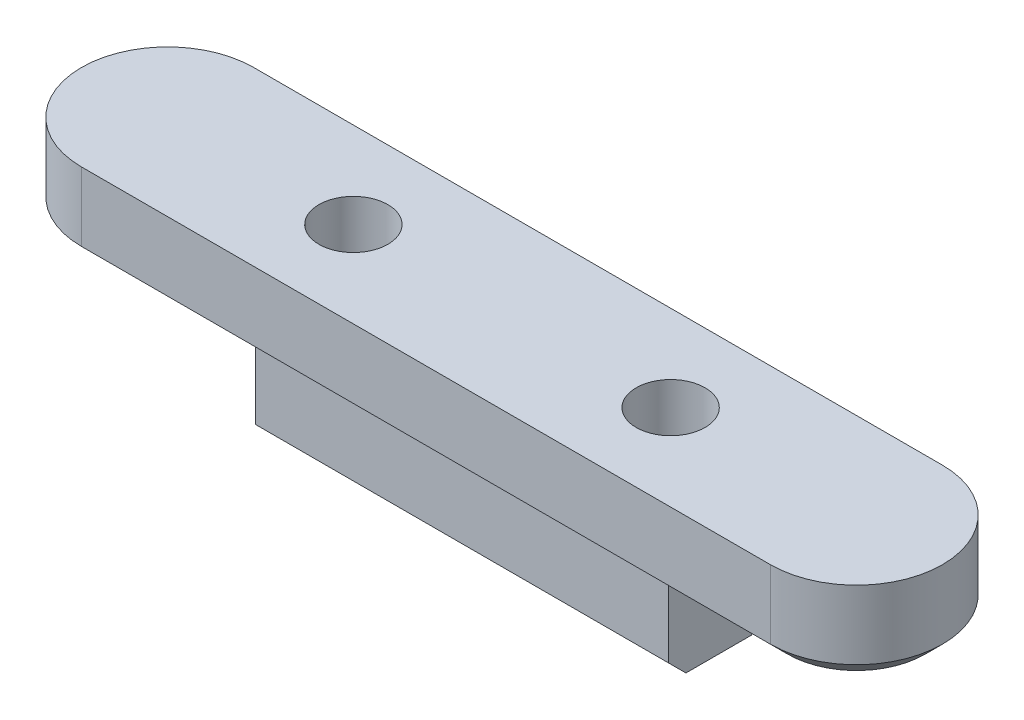
from build123d import *

# Parameters (mm, degrees)
BOSS_EXTRUDE1_DEPTH     = 5
SKETCH3_W               = 12
SKETCH3_H               = 5.8
BOSS_EXTRUDE2_DEPTH     = 6
CUT_EXTRUDE1_DEPTH      = 27.191601707
CUT_EXTRUDE1_DEPTH_BACK = 27.191601707
SKETCH4_R               = 1.6
SKETCH5_R               = 2
CUT_EXTRUDE2_DEPTH      = 4
CHAMFER2_SIZE           = 1


with BuildPart() as part:
    # Sketch1 → Boss-Extrude1 (new body)
    with BuildSketch(Plane(origin=(0, 0, 0), x_dir=(1, 0, 0), z_dir=(0, 1, 0))):
        with BuildLine():
            Line((0, 5), (-20, 5))
            ThreePointArc((-20, 5), (-25, 0), (-20, -5))
            Line((-20, -5), (0, -5))
            Line((0, -5), (0, 5))
        make_face()
    extrude(amount=BOSS_EXTRUDE1_DEPTH)

    # Sketch2 → Cut-Revolve1 (revolve, cut)
    with BuildSketch(Plane.XY):
        with BuildLine():
            Line((-20, 1), (-20, 0))
            Line((-20, 0), (-23.31662479, 0))
            ThreePointArc((-23.31662479, 0), (-21.732050808, 0.744562647), (-20, 1))
        make_face()
    revolve(axis=Axis((-20, -4.110143275, 0), (0, 1, 0)), mode=Mode.SUBTRACT)

    # Sketch3 → Boss-Extrude2 (add)
    with BuildSketch(Plane.XZ):
        with Locations((-6, 0)):
            Rectangle(SKETCH3_W, SKETCH3_H)
    extrude(amount=BOSS_EXTRUDE2_DEPTH)

    # Sketch4 → Cut-Extrude1 (cut, two sides: drawn at the far end of the back side and taken through both)
    with BuildSketch(Plane(origin=(0, 0, 0), x_dir=(1, 0, 0), z_dir=(0, 1, 0)).offset(-CUT_EXTRUDE1_DEPTH_BACK)):
        with Locations(Location((-9.210618834, 0, 0), (0, 0, 270))):
            Circle(SKETCH4_R)
    extrude(amount=CUT_EXTRUDE1_DEPTH + CUT_EXTRUDE1_DEPTH_BACK, mode=Mode.SUBTRACT)

    # Sketch5 → Cut-Extrude2 (cut)
    with BuildSketch(Plane(origin=(0, 5, 0), x_dir=(1, 0, 0), z_dir=(0, 1, 0))):
        with Locations(Location((-9.210618834, 0, 0), (0, 0, 270))):
            Circle(SKETCH5_R)
    extrude(amount=-CUT_EXTRUDE2_DEPTH, mode=Mode.SUBTRACT)

    # Mirror1: part across plane


with BuildPart() as part_1:
    add(part.part)
    add(part.part.mirror(Plane(origin=(0, 0, 0), x_dir=(0, 0, 1), z_dir=(1, 0, 0))))

    # Chamfer2
    chamfer2_edges = [part_1.edges().sort_by_distance(p)[0] for p in [
        (0, -6, 2.9),
        (0, -6, -2.9),
        (25, 0, 0),
        (0, 0, 5),
        (-25, 0, 0),
        (0, 0, -5),
    ]]
    chamfer(chamfer2_edges, length=CHAMFER2_SIZE)


solid = part_1.part
